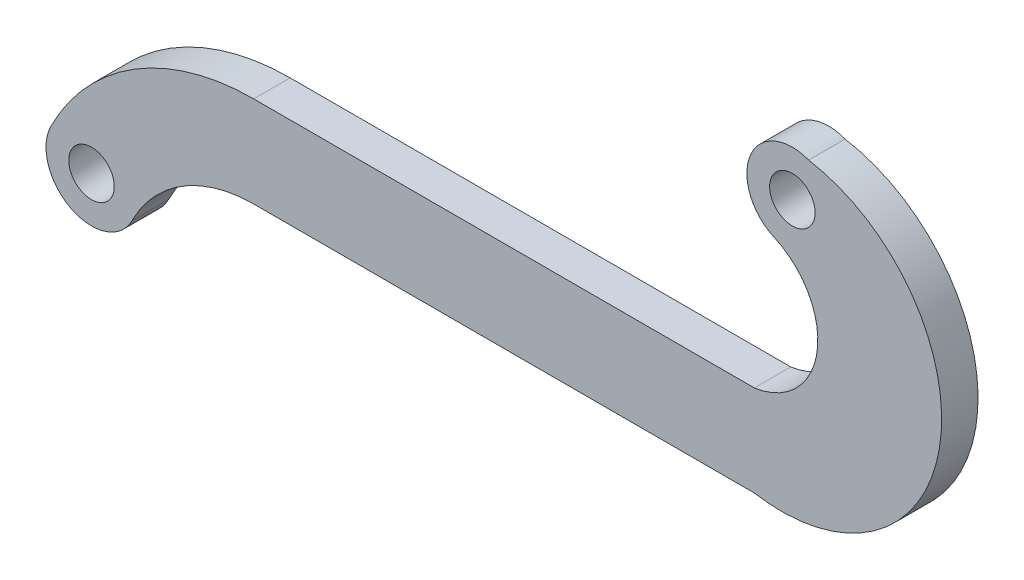
from build123d import *

# Parameters (mm, degrees)
SKETCH1_R           = 1
BOSS_EXTRUDE2_DEPTH = 1.6


with BuildPart() as part:
    # Sketch1 → Boss-Extrude2 (new body)
    with BuildSketch(Plane.XY):
        with BuildLine():
            Line((0, 0), (22, 0))
            ThreePointArc((22, 0), (30.128904766, 5.736453046), (24.39245172, 13.865357811))
            ThreePointArc((24.39245172, 13.865357811), (21.823365484, 12.765579929), (22.861725051, 10.171061692))
            ThreePointArc((22.861725051, 10.171061692), (24.759347978, 6.760381893), (22, 4))
            Line((22, 4), (0, 4))
            ThreePointArc((0, 4), (-5.239174154, 2.513368319), (-8.916737512, -1.503414886))
            ThreePointArc((-8.916737512, -1.503414886), (-8.025548834, -4.187773792), (-5.341189927, -3.296585114))
            ThreePointArc((-5.341189927, -3.296585114), (-3.138303015, -0.890503073), (0, 0))
        make_face()
        with Locations((-7.128963719, -2.4)):
            Circle(SKETCH1_R, mode=Mode.SUBTRACT)
        with Locations((23.671036281, 12)):
            Circle(SKETCH1_R, mode=Mode.SUBTRACT)
    extrude(amount=BOSS_EXTRUDE2_DEPTH)


solid = part.part
